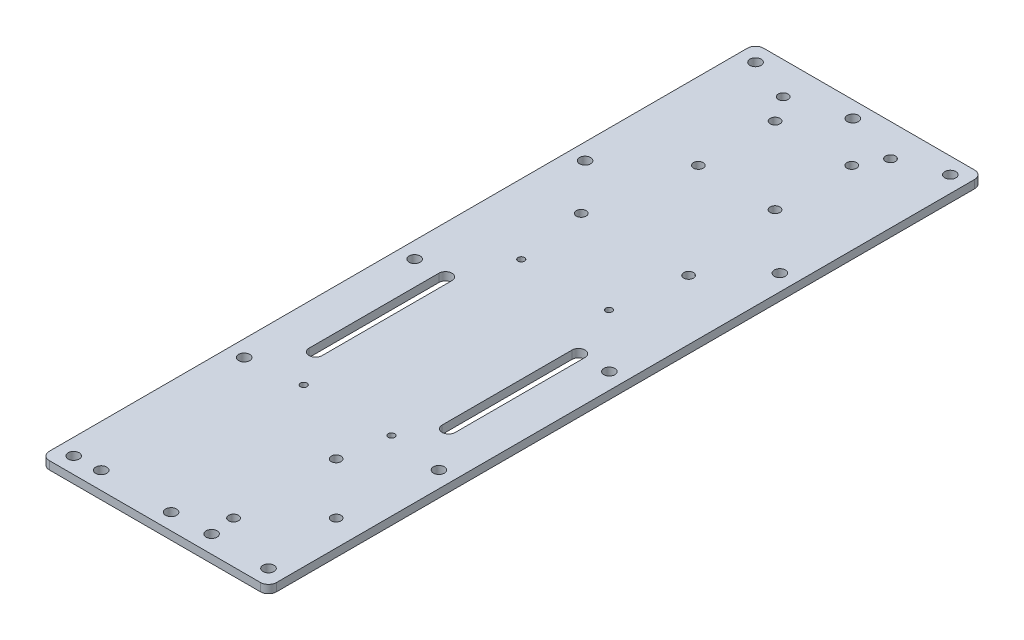
from build123d import *

# Parameters (mm, degrees)
PLATE_THICKNESS_DEPTH      = 3.175
SKETCH3_R                  = 2.159
MOUNTING_HOLES_DEPTH       = 147.635511132
SKETCH4_R                  = 1.905
JETSON_HOLES_W_MOUNT_DEPTH = 147.635511132
SKETCH5_R                  = 1.905
PDB_HOLES_DEPTH            = 147.635511132
SKETCH6_R                  = 1.905
LIDAR_HOLES_DEPTH          = 147.635511132
SKETCH7_R                  = 1.27
PIXHAWK_HOLES_DEPTH        = 147.635511132
BATTERY_HOLES_DEPTH        = 147.635511132
SKETCH9_R                  = 2.159
CUT_EXTRUDE1_DEPTH         = 147.635511132


with BuildPart() as part:
    # Sketch2 → Plate Thickness (new body)
    with BuildSketch(Plane(origin=(0, 0, 0), x_dir=(1, 0, 0), z_dir=(0, 1, 0))):
        with BuildLine():
            Line((-41.275, 139.7), (41.275, 139.7))
            ThreePointArc((41.275, 139.7), (43.52006403, 138.77006403), (44.45, 136.525))
            Line((44.45, 136.525), (44.45, -136.525))
            ThreePointArc((44.45, -136.525), (43.52006403, -138.77006403), (41.275, -139.7))
            Line((41.275, -139.7), (-41.275, -139.7))
            ThreePointArc((-41.275, -139.7), (-43.52006403, -138.77006403), (-44.45, -136.525))
            Line((-44.45, -136.525), (-44.45, 136.525))
            ThreePointArc((-44.45, 136.525), (-43.52006403, 138.77006403), (-41.275, 139.7))
        make_face()
    extrude(amount=PLATE_THICKNESS_DEPTH)

    # Sketch3 → Mounting holes (cut, through all)
    with BuildSketch(Plane(origin=(0, 3.175, 0), x_dir=(1, 0, 0), z_dir=(0, 1, 0))):
        with Locations(Location((-38.1, 133.35, 0), (0, 0, 270))):
            Circle(SKETCH3_R)
        with Locations(Location((-38.1, 66.675, 0), (0, 0, 270))):
            Circle(SKETCH3_R)
        with Locations(Location((-38.1, -66.675, 0), (0, 0, 90))):
            Circle(SKETCH3_R)
        with Locations(Location((-38.1, -133.35, 0), (0, 0, 90))):
            Circle(SKETCH3_R)
        with Locations(Location((38.1, -133.35, 0), (0, 0, 270))):
            Circle(SKETCH3_R)
        with Locations(Location((38.1, -66.675, 0), (0, 0, 270))):
            Circle(SKETCH3_R)
        with Locations(Location((38.1, 66.675, 0), (0, 0, 90))):
            Circle(SKETCH3_R)
        with Locations(Location((38.1, 133.35, 0), (0, 0, 90))):
            Circle(SKETCH3_R)
        with Locations(Location((0, 133.35, 0), (0, 0, 270))):
            Circle(SKETCH3_R)
        with Locations(Location((0, -133.35, 0), (0, 0, 90))):
            Circle(SKETCH3_R)
        with Locations(Location((-38.1, 0, 0), (0, 0, 270))):
            Circle(SKETCH3_R)
        with Locations(Location((38.1, 0, 0), (0, 0, 90))):
            Circle(SKETCH3_R)
    extrude(amount=-MOUNTING_HOLES_DEPTH, mode=Mode.SUBTRACT)

    # Sketch4 → Jetson Holes (w/ mount) (cut, through all)
    with BuildSketch(Plane(origin=(0, 3.175, 0), x_dir=(1, 0, 0), z_dir=(0, 1, 0))):
        with Locations(Location((-21.0058, 127.075242309, 0), (0, 0, 270))):
            Circle(SKETCH4_R)
        with Locations(Location((-21.0058, 48.081242309, 0), (0, 0, 270))):
            Circle(SKETCH4_R)
        with Locations(Location((21.0058, 48.081242309, 0), (0, 0, 90))):
            Circle(SKETCH4_R)
        with Locations(Location((21.0058, 127.075242309, 0), (0, 0, 90))):
            Circle(SKETCH4_R)
    extrude(amount=-JETSON_HOLES_W_MOUNT_DEPTH, mode=Mode.SUBTRACT)

    # Sketch5 → PDB holes (cut, through all)
    with BuildSketch(Plane(origin=(0, 3.175, 0), x_dir=(1, 0, 0), z_dir=(0, 1, 0))):
        with Locations(Location((-14.341868752, 117.235149692, 0), (0, 0, 270))):
            Circle(SKETCH5_R)
        with Locations(Location((15.655531248, 117.235149692, 0), (0, 0, 270))):
            Circle(SKETCH5_R)
        with Locations(Location((15.655531248, 87.237749692, 0), (0, 0, 270))):
            Circle(SKETCH5_R)
        with Locations(Location((-14.341868752, 87.237749692, 0), (0, 0, 270))):
            Circle(SKETCH5_R)
    extrude(amount=-PDB_HOLES_DEPTH, mode=Mode.SUBTRACT)

    # Sketch6 → Lidar Holes (cut, through all)
    with BuildSketch(Plane(origin=(0, 3.175, 0), x_dir=(1, 0, 0), z_dir=(0, 1, 0))):
        with Locations(Location((34.29, -103.082806339, 0), (0, 0, 270))):
            Circle(SKETCH6_R)
        with Locations(Location((14.224, -83.016806339, 0), (0, 0, 270))):
            Circle(SKETCH6_R)
        with Locations(Location((14.224, -123.148806339, 0), (0, 0, 270))):
            Circle(SKETCH6_R)
    extrude(amount=-LIDAR_HOLES_DEPTH, mode=Mode.SUBTRACT)

    # Sketch7 → PixHawk Holes (cut, through all)
    with BuildSketch(Plane(origin=(0, 3.175, 0), x_dir=(1, 0, 0), z_dir=(0, 1, 0))):
        with Locations(Location((-17.145, 20.769931445, 0), (0, 0, 270))):
            Circle(SKETCH7_R)
        with Locations(Location((-17.145, -64.320068555, 0), (0, 0, 270))):
            Circle(SKETCH7_R)
        with Locations(Location((17.145, -64.320068555, 0), (0, 0, 270))):
            Circle(SKETCH7_R)
        with Locations(Location((17.145, 20.769931445, 0), (0, 0, 270))):
            Circle(SKETCH7_R)
    extrude(amount=-PIXHAWK_HOLES_DEPTH, mode=Mode.SUBTRACT)

    # Sketch8 → Battery Holes (cut, through all)
    with BuildSketch(Plane(origin=(0, 3.175, 0), x_dir=(1, 0, 0), z_dir=(0, 1, 0))):
        with BuildLine():
            Line((-23.495, -0.005964701), (-23.495, -50.805964701))
            ThreePointArc((-23.495, -50.805964701), (-26.035, -53.345964701), (-28.575, -50.805964701))
            Line((-28.575, -50.805964701), (-28.575, -0.005964701))
            ThreePointArc((-28.575, -0.005964701), (-26.035, 2.534035299), (-23.495, -0.005964701))
        make_face()
        with BuildLine():
            Line((23.495, -0.005964701), (23.495, -50.805964701))
            ThreePointArc((23.495, -50.805964701), (26.035, -53.345964701), (28.575, -50.805964701))
            Line((28.575, -50.805964701), (28.575, -0.005964701))
            ThreePointArc((28.575, -0.005964701), (26.035, 2.534035299), (23.495, -0.005964701))
        make_face()
    extrude(amount=-BATTERY_HOLES_DEPTH, mode=Mode.SUBTRACT)

    # Sketch9 → Cut-Extrude1 (cut, through all)
    with BuildSketch(Plane(origin=(0, 3.175, 0), x_dir=(1, 0, 0), z_dir=(0, 1, 0))):
        with Locations(Location((-27.868680575, -132.830834732, 0), (0, 0, 270))):
            Circle(SKETCH9_R)
        with Locations(Location((15.311319425, -132.830834732, 0), (0, 0, 270))):
            Circle(SKETCH9_R)
    extrude(amount=-CUT_EXTRUDE1_DEPTH, mode=Mode.SUBTRACT)


solid = part.part
